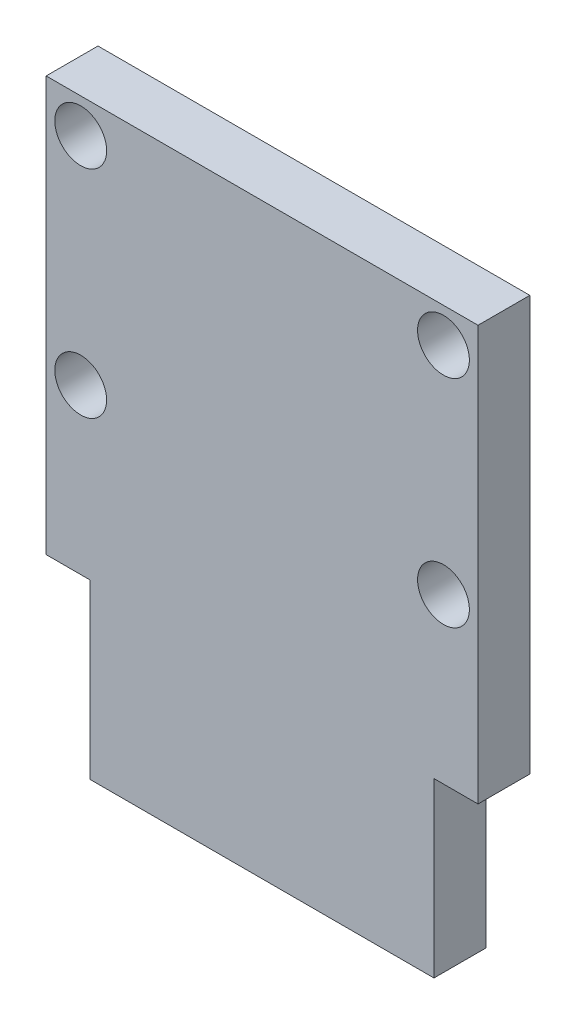
from build123d import *

# Parameters (mm, degrees)
SKETCH1_W           = 25
SKETCH1_H           = 24
SKETCH1_R           = 1.5
SKETCH1_W_2         = 19.9
SKETCH1_H_2         = 10
BOSS_EXTRUDE1_DEPTH = 3


with BuildPart() as part:
    # Sketch1 → Boss-Extrude1 (new body)
    # profile 1 of 2: a face of its own
    with BuildSketch(Plane.XY):
        with Locations((12.5, 12)):
            Rectangle(SKETCH1_W, SKETCH1_H)
        with Locations((23, 22)):
            Circle(SKETCH1_R, mode=Mode.SUBTRACT)
        with Locations((2, 22)):
            Circle(SKETCH1_R, mode=Mode.SUBTRACT)
        with Locations((23, 9.5)):
            Circle(SKETCH1_R, mode=Mode.SUBTRACT)
        with Locations((2, 9.5)):
            Circle(SKETCH1_R, mode=Mode.SUBTRACT)
    # profile 2 of 2: a face of its own
    with BuildSketch(Plane.XY):
        with Locations((12.5, -5)):
            Rectangle(SKETCH1_W_2, SKETCH1_H_2)
    extrude(amount=BOSS_EXTRUDE1_DEPTH)


solid = part.part
